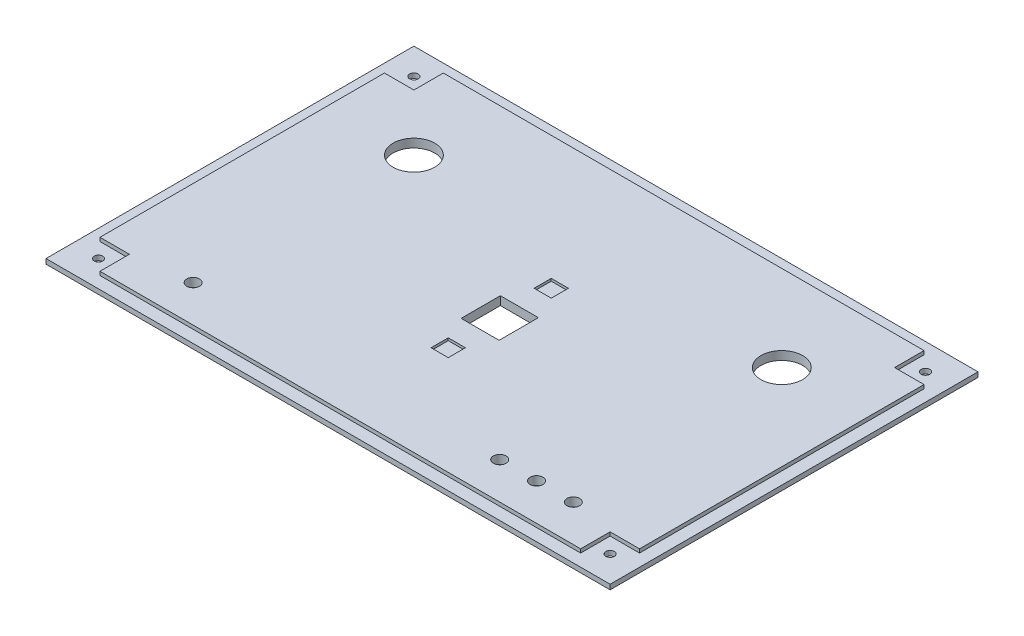
from build123d import *

# Parameters (mm, degrees)
SKETCH1_W               = 230
SKETCH1_H               = 150
BOSS_EXTRUDE1_DEPTH     = 3.5
SKETCH4_R               = 8.5
SKETCH4_W               = 15.5
SKETCH4_H               = 16
CUT_EXTRUDE2_DEPTH      = 100
SKETCH2_W               = 230
SKETCH2_H               = 150
SKETCH2_W_2             = 220
SKETCH2_H_2             = 140
CUT_EXTRUDE3_DEPTH      = 1.5
SKETCH5_W               = 12
SKETCH5_H               = 12
SKETCH5_R               = 1.75
CUT_EXTRUDE4_DEPTH      = 1.5
SKETCH7_R               = 1.75
CUT_EXTRUDE5_DEPTH      = 10
MIRROR2_COPY_1_SKETCH_W = 12
MIRROR2_COPY_1_SKETCH_H = 12
MIRROR2_COPY_1_SKETCH_R = 1.75
MIRROR2_COPY_1_DEPTH    = 1.5
MIRROR2_COPY_2_SKETCH_R = 1.75
MIRROR2_COPY_2_DEPTH    = 10
SKETCH8_R               = 2.6
CUT_EXTRUDE6_DEPTH      = 10
SKETCH9_W               = 7
SKETCH9_H               = 7
CUT_EXTRUDE7_DEPTH      = 1


with BuildPart() as part:
    # Sketch1 → Boss-Extrude1 (new body)
    with BuildSketch(Plane(origin=(0, 0, 0), x_dir=(1, 0, 0), z_dir=(0, 1, 0))):
        Rectangle(SKETCH1_W, SKETCH1_H)
    extrude(amount=BOSS_EXTRUDE1_DEPTH)

    # Sketch4 → Cut-Extrude2 (cut)
    with BuildSketch(Plane.XZ):
        with Locations(Location((-75, -35, 0), (0, 0, 270))):
            Circle(SKETCH4_R)
        with Locations(Location((75, -35, 0), (0, 0, 90))):
            Circle(SKETCH4_R)
        with Locations((0, 5)):
            Rectangle(SKETCH4_W, SKETCH4_H)
    extrude(amount=-CUT_EXTRUDE2_DEPTH, mode=Mode.SUBTRACT)

    # Sketch2 → Cut-Extrude3 (cut)
    with BuildSketch(Plane(origin=(0, 3.5, 0), x_dir=(1, 0, 0), z_dir=(0, 1, 0))):
        Rectangle(SKETCH2_W, SKETCH2_H)
        Rectangle(SKETCH2_W_2, SKETCH2_H_2, mode=Mode.SUBTRACT)
    extrude(amount=-CUT_EXTRUDE3_DEPTH, mode=Mode.SUBTRACT)

    # Sketch5 → Cut-Extrude4 (cut)
    with BuildSketch(Plane(origin=(0, 3.5, 0), x_dir=(1, 0, 0), z_dir=(0, 1, 0))):
        with Locations((-104, 64)):
            Rectangle(SKETCH5_W, SKETCH5_H)
        with Locations(Location((-104.3, 64.3, 0), (0, 0, 270))):
            Circle(SKETCH5_R, mode=Mode.SUBTRACT)
    cut_extrude4 = extrude(amount=-CUT_EXTRUDE4_DEPTH, mode=Mode.SUBTRACT)

    # Sketch7 → Cut-Extrude5 (cut)
    with BuildSketch(Plane(origin=(0, 3.5, 0), x_dir=(1, 0, 0), z_dir=(0, 1, 0))):
        with Locations(Location((-104.3, 64.3, 0), (0, 0, 270))):
            Circle(SKETCH7_R)
    cut_extrude5 = extrude(amount=-CUT_EXTRUDE5_DEPTH, mode=Mode.SUBTRACT)

    # Mirror1: Cut-Extrude4, Cut-Extrude5 across plane
    add(cut_extrude4.mirror(Plane(origin=(0, 0, 0), x_dir=(0, 0, 1), z_dir=(1, 0, 0))), mode=Mode.SUBTRACT)
    add(cut_extrude5.mirror(Plane(origin=(0, 0, 0), x_dir=(0, 0, 1), z_dir=(1, 0, 0))), mode=Mode.SUBTRACT)

    # Mirror2: Cut-Extrude4, Cut-Extrude5 across plane
    add(cut_extrude4.mirror(Plane.XY), mode=Mode.SUBTRACT)
    add(cut_extrude5.mirror(Plane.XY), mode=Mode.SUBTRACT)

    # Mirror2 copy 1 sketch → Mirror2 copy 1 (cut)
    with BuildSketch(Plane(origin=(0, 3.5, 0), x_dir=(-1, 0, 0), z_dir=(0, 1, 0))):
        with Locations((-104, 64)):
            Rectangle(MIRROR2_COPY_1_SKETCH_W, MIRROR2_COPY_1_SKETCH_H)
        with Locations(Location((-104.3, 64.3, 0), (0, 0, 270))):
            Circle(MIRROR2_COPY_1_SKETCH_R, mode=Mode.SUBTRACT)
    extrude(amount=-MIRROR2_COPY_1_DEPTH, mode=Mode.SUBTRACT)

    # Mirror2 copy 2 sketch → Mirror2 copy 2 (cut)
    with BuildSketch(Plane(origin=(0, 3.5, 0), x_dir=(-1, 0, 0), z_dir=(0, 1, 0))):
        with Locations(Location((-104.3, 64.3, 0), (0, 0, 270))):
            Circle(MIRROR2_COPY_2_SKETCH_R)
    extrude(amount=-MIRROR2_COPY_2_DEPTH, mode=Mode.SUBTRACT)

    # Sketch8 → Cut-Extrude6 (cut)
    with BuildSketch(Plane.XZ):
        with BuildLine():
            ThreePointArc((-72.4, 55), (-75, 57.6), (-77.6, 55))
            Line((-77.6, 55), (-72.4, 55))
        make_face()
        with BuildLine():
            Line((-72.4, 55), (-77.6, 55))
            ThreePointArc((-77.6, 55), (-75, 52.4), (-72.4, 55))
        make_face()
        with Locations(Location((50, 55, 0), (0, 0, 270))):
            Circle(SKETCH8_R)
        with Locations(Location((65, 55, 0), (0, 0, 270))):
            Circle(SKETCH8_R)
        with Locations(Location((80, 55, 0), (0, 0, 270))):
            Circle(SKETCH8_R)
    extrude(amount=-CUT_EXTRUDE6_DEPTH, mode=Mode.SUBTRACT)

    # Sketch9 → Cut-Extrude7 (cut)
    with BuildSketch(Plane(origin=(0, 3.5, 0), x_dir=(1, 0, 0), z_dir=(0, 1, 0))):
        with Locations((0, 16)):
            Rectangle(SKETCH9_W, SKETCH9_H)
        with Locations((0, -26)):
            Rectangle(SKETCH9_W, SKETCH9_H)
    extrude(amount=-CUT_EXTRUDE7_DEPTH, mode=Mode.SUBTRACT)


solid = part.part
